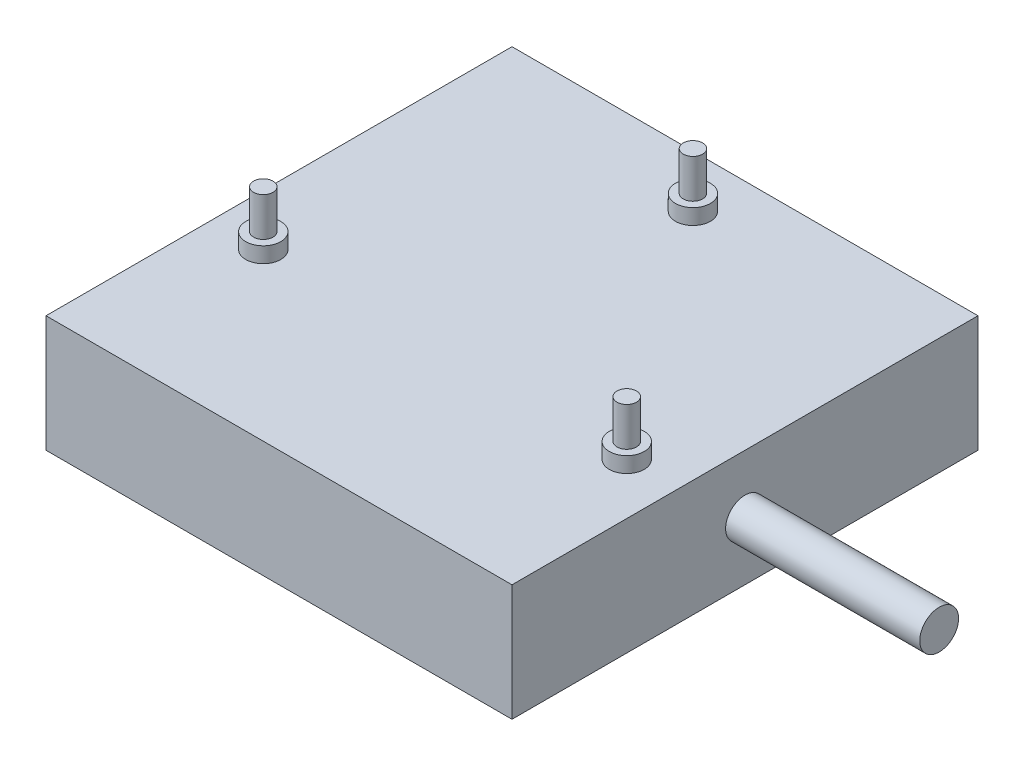
from build123d import *

# Parameters (mm, degrees)
SKETCH2_W           = 60
SKETCH2_H           = 60
BOSS_EXTRUDE1_DEPTH = 15
CUT_EXTRUDE1_DEPTH  = 3
SKETCH1_R           = 2.25
BOSS_EXTRUDE2_DEPTH = 2
SKETCH4_R           = 1.25
BOSS_EXTRUDE3_DEPTH = 5
SKETCH5_R           = 2.5
BOSS_EXTRUDE4_DEPTH = 25


with BuildPart() as part:
    # Sketch2 → Boss-Extrude1 (new body)
    with BuildSketch(Plane(origin=(0, 0, 0), x_dir=(1, 0, 0), z_dir=(0, 1, 0))):
        Rectangle(SKETCH2_W, SKETCH2_H)
    extrude(amount=-BOSS_EXTRUDE1_DEPTH)

    # Sketch3 → Cut-Extrude1 (cut)
    with BuildSketch(Plane.ZY.offset(30)):
        with BuildLine():
            Line((-6.5, -7.5), (-13, -7.5))
            ThreePointArc((-13, -7.5), (-14.035987291, -9.767742066), (-16.428436053, -10.469249492))
            Line((-16.428436053, -10.469249492), (-4.5, -12.19041576))
            ThreePointArc((-4.5, -12.19041576), (-5.979130372, -10.049509757), (-6.5, -7.5))
        make_face()
        with BuildLine():
            ThreePointArc((-16.428436053, -10.469249492), (-14.035987291, -9.767742066), (-13, -7.5))
            Line((-13, -7.5), (-19, -7.5))
            ThreePointArc((-19, -7.5), (-18.267742066, -9.464012709), (-16.428436053, -10.469249492))
        make_face()
        with BuildLine():
            Line((-19, -7.5), (-13, -7.5))
            ThreePointArc((-13, -7.5), (-14.035987291, -5.232257934), (-16.428436053, -4.530750508))
            ThreePointArc((-16.428436053, -4.530750508), (-18.267742066, -5.535987291), (-19, -7.5))
        make_face()
        with BuildLine():
            ThreePointArc((-16.428436053, -4.530750508), (-14.035987291, -5.232257934), (-13, -7.5))
            Line((-13, -7.5), (-6.5, -7.5))
            ThreePointArc((-6.5, -7.5), (-5.979130372, -4.950490243), (-4.5, -2.80958424))
            Line((-4.5, -2.80958424), (-16.428436053, -4.530750508))
        make_face()
        with BuildLine():
            ThreePointArc((0, -12), (-3.18198051, -10.681980521), (-4.5, -7.500000016))
            Line((-4.5, -7.500000016), (-4.5, -12.19041576))
            ThreePointArc((-4.5, -12.19041576), (-2.425107994, -13.530659269), (0, -14))
            Line((0, -14), (0, -12))
        make_face()
        with BuildLine():
            Line((-4.5, -2.80958424), (-4.5, -7.500000016))
            ThreePointArc((-4.5, -7.500000016), (-3.181980521, -4.31801949), (0, -3))
            Line((0, -3), (0, -1))
            ThreePointArc((0, -1), (-2.425107994, -1.469340731), (-4.5, -2.80958424))
        make_face()
        with BuildLine():
            ThreePointArc((-4.5, -2.80958424), (-5.979130372, -4.950490243), (-6.5, -7.5))
            Line((-6.5, -7.5), (-4.5, -7.5))
            Line((-4.5, -7.500000016), (-4.5, -2.80958424))
        make_face()
        with BuildLine():
            Line((-4.5, -7.5), (-6.5, -7.5))
            ThreePointArc((-6.5, -7.5), (-5.979130372, -10.049509757), (-4.5, -12.19041576))
            Line((-4.5, -12.19041576), (-4.5, -7.500000016))
        make_face()
        with BuildLine():
            Line((0, -1), (0, -3))
            ThreePointArc((0, -3), (3.181980515, -4.318019485), (4.5, -7.5))
            Line((4.5, -7.5), (4.5, -2.80958424))
            ThreePointArc((4.5, -2.80958424), (2.425107994, -1.469340731), (0, -1))
        make_face()
        with BuildLine():
            ThreePointArc((4.5, -7.5), (3.181980515, -10.681980515), (0, -12))
            Line((0, -12), (0, -14))
            ThreePointArc((0, -14), (2.425107994, -13.530659269), (4.5, -12.19041576))
            Line((4.5, -12.19041576), (4.5, -7.5))
        make_face()
        with BuildLine():
            Line((0, -3), (0, -7.5))
            Line((0, -7.5), (4.5, -7.5))
            ThreePointArc((4.5, -7.5), (3.181980515, -4.318019485), (0, -3))
        make_face()
        with BuildLine():
            Line((4.5, -7.5), (0, -7.5))
            Line((0, -7.5), (0, -12))
            ThreePointArc((0, -12), (3.181980515, -10.681980515), (4.5, -7.5))
        make_face()
        with BuildLine():
            ThreePointArc((0, -3), (-3.181980521, -4.31801949), (-4.5, -7.500000016))
            Line((-4.5, -7.5), (0, -7.5))
            Line((0, -7.5), (0, -3))
        make_face()
        with BuildLine():
            Line((0, -7.5), (-4.5, -7.5))
            ThreePointArc((-4.5, -7.500000016), (-3.18198051, -10.681980521), (0, -12))
            Line((0, -12), (0, -7.5))
        make_face()
        with BuildLine():
            Line((4.5, -2.80958424), (4.5, -7.5))
            Line((4.5, -7.5), (6.5, -7.5))
            ThreePointArc((6.5, -7.5), (5.979130372, -4.950490243), (4.5, -2.80958424))
        make_face()
        with BuildLine():
            Line((6.5, -7.5), (4.5, -7.5))
            Line((4.5, -7.5), (4.5, -12.19041576))
            ThreePointArc((4.5, -12.19041576), (5.979130372, -10.049509757), (6.5, -7.5))
        make_face()
        with BuildLine():
            ThreePointArc((6.5, -7.5), (5.979130372, -10.049509757), (4.5, -12.19041576))
            Line((4.5, -12.19041576), (16.428436053, -10.469249492))
            ThreePointArc((16.428436053, -10.469249492), (14.035987291, -9.767742066), (13, -7.5))
            Line((13, -7.5), (6.5, -7.5))
        make_face()
        with BuildLine():
            Line((16.428436053, -4.530750508), (4.5, -2.80958424))
            ThreePointArc((4.5, -2.80958424), (5.979130372, -4.950490243), (6.5, -7.5))
            Line((6.5, -7.5), (13, -7.5))
            ThreePointArc((13, -7.5), (14.035987291, -5.232257934), (16.428436053, -4.530750508))
        make_face()
        with BuildLine():
            ThreePointArc((19, -7.5), (18.267742066, -5.535987291), (16.428436053, -4.530750508))
            ThreePointArc((16.428436053, -4.530750508), (14.035987291, -5.232257934), (13, -7.5))
            Line((13, -7.5), (19, -7.5))
        make_face()
        with BuildLine():
            ThreePointArc((13, -7.5), (14.035987291, -9.767742066), (16.428436053, -10.469249492))
            ThreePointArc((16.428436053, -10.469249492), (18.267742066, -9.464012709), (19, -7.5))
            Line((19, -7.5), (13, -7.5))
        make_face()
    extrude(amount=-CUT_EXTRUDE1_DEPTH, mode=Mode.SUBTRACT)

    # Sketch1 → Boss-Extrude2 (add)
    with BuildSketch(Plane(origin=(0, 0, 0), x_dir=(1, 0, 0), z_dir=(0, 1, 0))):
        with Locations(Location((-23.4, -8.623991148, 0), (0, 0, 90))):
            Circle(SKETCH1_R)
        with Locations(Location((0, 23.296008852, 0), (0, 0, 90))):
            Circle(SKETCH1_R)
        with Locations(Location((23.4, -8.623991148, 0), (0, 0, 90))):
            Circle(SKETCH1_R)
    extrude(amount=BOSS_EXTRUDE2_DEPTH)

    # Sketch4 → Boss-Extrude3 (add)
    with BuildSketch(Plane(origin=(0, 2, 0), x_dir=(1, 0, 0), z_dir=(0, 1, 0))):
        with Locations(Location((-23.4, -8.623991148, 0), (0, 0, 270))):
            Circle(SKETCH4_R)
        with Locations(Location((23.4, -8.623991148, 0), (0, 0, 270))):
            Circle(SKETCH4_R)
        with Locations(Location((0, 23.296008852, 0), (0, 0, 270))):
            Circle(SKETCH4_R)
    extrude(amount=BOSS_EXTRUDE3_DEPTH)

    # Sketch5 → Boss-Extrude4 (add)
    with BuildSketch(Plane(origin=(30, 0, 0), x_dir=(0, 0, -1), z_dir=(1, 0, 0))):
        with Locations((0, -7.5)):
            Circle(SKETCH5_R)
    extrude(amount=BOSS_EXTRUDE4_DEPTH)


solid = part.part
